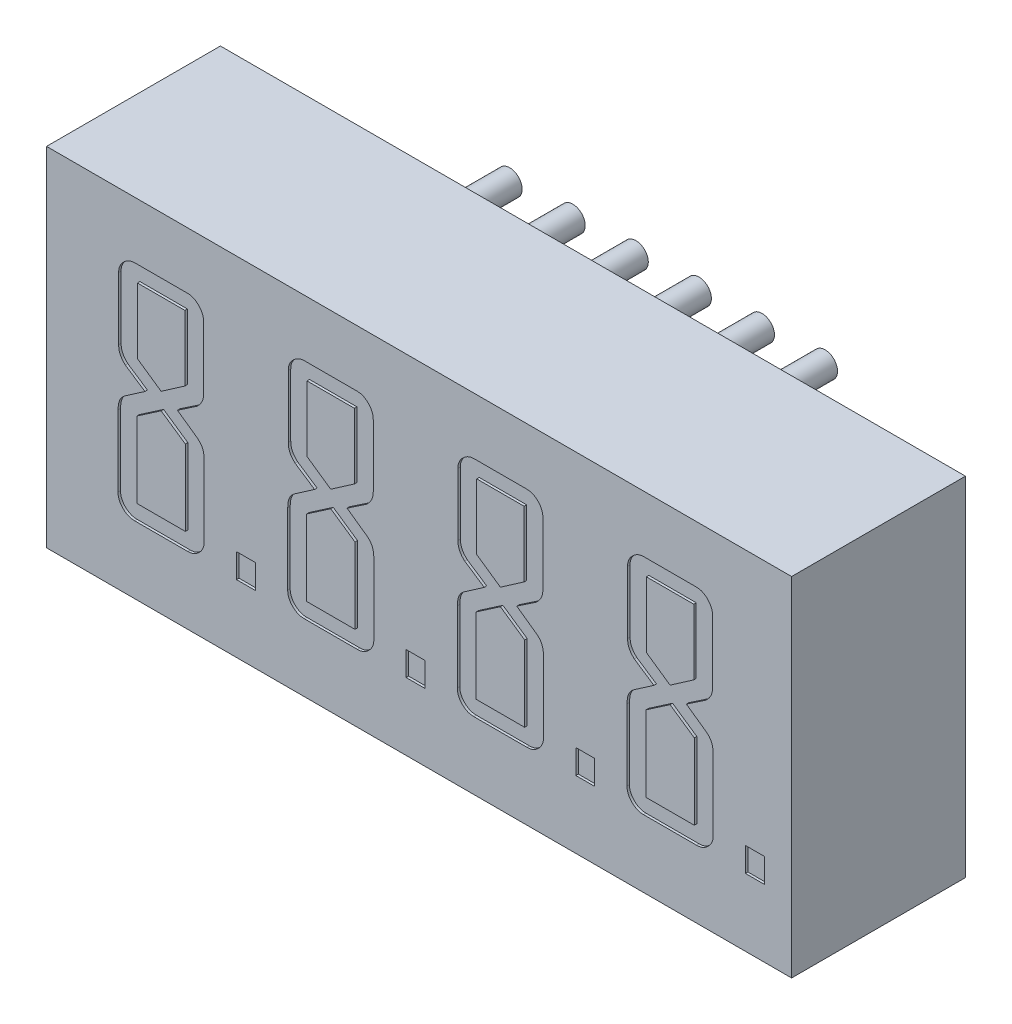
from build123d import *

# Parameters (mm, degrees)
SKETCH_1_W          = 30
SKETCH_1_H          = 14
EXTRUDE_1_DEPTH     = 7
SKETCH_2_R          = 0.5
EXTRUDE_2_DEPTH     = 3
SKETCH_3_W          = 0.759036144
SKETCH_3_H          = 0.975903615
SKETCH_3_W_2        = 0.759036145
CUT_EXTRUDE_1_DEPTH = 0.1


with BuildPart() as part:
    # 草图1 → 凸台-拉伸1 (new body)
    with BuildSketch(Plane.XY):
        Rectangle(SKETCH_1_W, SKETCH_1_H)
    extrude(amount=EXTRUDE_1_DEPTH)

    # 草图2 → 凸台-拉伸2 (add)
    with BuildSketch(Plane(origin=(0, 0, 0), x_dir=(-1, 0, 0), z_dir=(0, 0, -1))):
        with Locations((-6.35, -5.08)):
            Circle(SKETCH_2_R)
        with Locations((-3.81, -5.08)):
            Circle(SKETCH_2_R)
        with Locations((-1.27, -5.08)):
            Circle(SKETCH_2_R)
        with Locations((1.27, -5.08)):
            Circle(SKETCH_2_R)
        with Locations((3.81, -5.08)):
            Circle(SKETCH_2_R)
        with Locations((6.35, -5.08)):
            Circle(SKETCH_2_R)
        with Locations((-6.35, 5.08)):
            Circle(SKETCH_2_R)
        with Locations((-3.81, 5.08)):
            Circle(SKETCH_2_R)
        with Locations((-1.27, 5.08)):
            Circle(SKETCH_2_R)
        with Locations((1.27, 5.08)):
            Circle(SKETCH_2_R)
        with Locations((3.81, 5.08)):
            Circle(SKETCH_2_R)
        with Locations((6.35, 5.08)):
            Circle(SKETCH_2_R)
    extrude(amount=EXTRUDE_2_DEPTH)

    # 草图3 → 切除-拉伸1 (cut)
    # profile 1 of 8: a face of its own
    with BuildSketch(Plane.XY.offset(7)):
        with BuildLine():
            add(Edge.make_bspline(
                [(-8.652504459, -3.619299161), (-8.654362737, -3.66257673), (-8.658038164, -3.748173989), (-8.700630441, -3.870877019), (-8.763145764, -3.98628404), (-8.85161174, -4.088000843), (-8.954833811, -4.173294922), (-9.067943731, -4.237665873), (-9.189816429, -4.277361922), (-9.274011462, -4.281406816), (-9.316661085, -4.283455788)],
                knots=[0, 0, 0, 0, 0.997190107, 1.972309053, 2.972319829, 4.019608879, 5.068526684, 6.057120165, 7.015819712, 8, 8, 8, 8], degree=3))
            Line((-9.316661085, -4.283455788), (-11.45822735, -4.283455788))
            add(Edge.make_bspline(
                [(-11.45822735, -4.283455788), (-11.502017128, -4.281467222), (-11.587904853, -4.277566921), (-11.711873081, -4.237579103), (-11.826378976, -4.174282188), (-11.928373853, -4.087815088), (-12.015224794, -3.986210112), (-12.076151405, -3.870756342), (-12.116432187, -3.747885473), (-12.120382641, -3.662537314), (-12.122383977, -3.619299161)],
                knots=[0, 0, 0, 0, 1.007527941, 1.976129771, 2.97349409, 4.009605341, 5.045716591, 6.036847056, 7.005448885, 8, 8, 8, 8], degree=3))
            Line((-12.122383977, -3.619299161), (-12.122383977, -0.752582294))
            add(Edge.make_bspline(
                [(-12.122383977, -0.752582294), (-12.11964933, -0.684415019), (-12.114521929, -0.556602889), (-12.063204888, -0.379624731), (-11.975896076, -0.231930263), (-11.891426195, -0.162010932), (-11.849605362, -0.127394041)],
                knots=[0, 0, 0, 0, 1.150327782, 2.156839091, 3.087455516, 4, 4, 4, 4], degree=3))
            Line((-11.849605362, -0.127394041), (-11.038046627, 0.433411682))
            Line((-11.038046627, 0.433411682), (-11.82757976, 0.958637586))
            add(Edge.make_bspline(
                [(-11.82757976, 0.958637586), (-11.869036888, 0.998813623), (-11.949235147, 1.076533629), (-12.035762668, 1.218088737), (-12.089608975, 1.372748965), (-12.095608181, 1.481161938), (-12.098664097, 1.53638608)],
                knots=[0, 0, 0, 0, 1.048816126, 2.028920755, 2.995958189, 4, 4, 4, 4], degree=3))
            Line((-12.098664097, 1.53638608), (-12.098664097, 4.052387586))
            add(Edge.make_bspline(
                [(-12.098664097, 4.052387586), (-12.09682249, 4.095675708), (-12.093180038, 4.18129384), (-12.05059827, 4.303110244), (-11.989570188, 4.418524118), (-11.900583237, 4.519185082), (-11.798387754, 4.607079574), (-11.683042358, 4.670643367), (-11.559109386, 4.710661592), (-11.473216863, 4.714557756), (-11.429424639, 4.716544212)],
                knots=[0, 0, 0, 0, 0.99216494, 1.962369941, 2.939690395, 3.981701811, 5.033640061, 6.028611456, 6.994889369, 8, 8, 8, 8], degree=3))
            Line((-11.429424639, 4.716544212), (-9.328521025, 4.716544212))
            add(Edge.make_bspline(
                [(-9.328521025, 4.716544212), (-9.285848701, 4.714561088), (-9.202148942, 4.710671282), (-9.081561793, 4.670561392), (-8.969573202, 4.606956511), (-8.870625939, 4.518642196), (-8.783827481, 4.417993686), (-8.722056628, 4.303481126), (-8.682238749, 4.180944908), (-8.678246731, 4.09561599), (-8.676224338, 4.052387586)],
                knots=[0, 0, 0, 0, 0.992302972, 1.946355689, 2.931638389, 3.977580693, 5.025015187, 6.015392545, 6.994579835, 8, 8, 8, 8], degree=3))
            Line((-8.676224338, 4.052387586), (-8.676224338, 1.53638608))
            add(Edge.make_bspline(
                [(-8.676224338, 1.53638608), (-8.679136007, 1.481119191), (-8.684861714, 1.372438562), (-8.741027983, 1.217948384), (-8.829144577, 1.076453744), (-8.910375891, 0.998801819), (-8.952391507, 0.958637586)],
                knots=[0, 0, 0, 0, 1.000069684, 1.966606104, 2.948259069, 4, 4, 4, 4], degree=3))
            Line((-8.952391507, 0.958637586), (-9.730064699, 0.433411682))
            Line((-9.730064699, 0.433411682), (-8.93883729, -0.127394041))
            add(Edge.make_bspline(
                [(-8.93883729, -0.127394041), (-8.894660406, -0.162989963), (-8.806528859, -0.234002752), (-8.715220385, -0.383675857), (-8.662488686, -0.559868435), (-8.655948448, -0.686107004), (-8.652504459, -0.752582294)],
                knots=[0, 0, 0, 0, 0.945503828, 1.88625157, 2.886932559, 4, 4, 4, 4], degree=3))
            Line((-8.652504459, -0.752582294), (-8.652504459, -3.619299161))
        make_face()
        Polygon((-9.433566205, 1.426258068), (-9.433566205, 4.065941803), (-11.34132223, 4.065941803), (-11.34132223, 1.426258068), (-10.387444218, 0.765489995), align=None, mode=Mode.SUBTRACT)
        Polygon((-9.411540603, -3.632853378), (-9.411540603, -0.58484886), (-10.387444218, 0.084390598), (-11.363347832, -0.58484886), (-11.363347832, -3.632853378), align=None, mode=Mode.SUBTRACT)
    # profile 2 of 8: a face of its own
    with BuildSketch(Plane.XY.offset(7)):
        with Locations((-6.971781567, -3.795503981)):
            Rectangle(SKETCH_3_W, SKETCH_3_H)
    # profile 3 of 8: a face of its own
    with BuildSketch(Plane.XY.offset(7)):
        with BuildLine():
            add(Edge.make_bspline(
                [(-1.821179157, -3.619299161), (-1.823037436, -3.66257673), (-1.826712863, -3.748173989), (-1.86930514, -3.870877019), (-1.931820462, -3.98628404), (-2.020286439, -4.088000843), (-2.12350851, -4.173294922), (-2.236618429, -4.237665873), (-2.358491128, -4.277361922), (-2.442686161, -4.281406816), (-2.485335784, -4.283455788)],
                knots=[0, 0, 0, 0, 0.997190107, 1.972309053, 2.972319829, 4.019608879, 5.068526684, 6.057120165, 7.015819712, 8, 8, 8, 8], degree=3))
            Line((-2.485335784, -4.283455788), (-4.626902049, -4.283455788))
            add(Edge.make_bspline(
                [(-4.626902049, -4.283455788), (-4.670691827, -4.281467222), (-4.756579552, -4.277566921), (-4.880547779, -4.237579103), (-4.995053675, -4.174282188), (-5.097048552, -4.087815088), (-5.183899493, -3.986210112), (-5.244826104, -3.870756342), (-5.285106886, -3.747885473), (-5.28905734, -3.662537314), (-5.291058675, -3.619299161)],
                knots=[0, 0, 0, 0, 1.007527941, 1.976129771, 2.97349409, 4.009605341, 5.045716591, 6.036847056, 7.005448885, 8, 8, 8, 8], degree=3))
            Line((-5.291058675, -3.619299161), (-5.291058675, -0.752582294))
            add(Edge.make_bspline(
                [(-5.291058675, -0.752582294), (-5.288324029, -0.684415019), (-5.283196628, -0.556602889), (-5.231879586, -0.379624731), (-5.144570775, -0.231930263), (-5.060100894, -0.162010932), (-5.018280061, -0.127394041)],
                knots=[0, 0, 0, 0, 1.150327782, 2.156839091, 3.087455516, 4, 4, 4, 4], degree=3))
            Line((-5.018280061, -0.127394041), (-4.206721326, 0.433411682))
            Line((-4.206721326, 0.433411682), (-4.996254459, 0.958637586))
            add(Edge.make_bspline(
                [(-4.996254459, 0.958637586), (-5.037711587, 0.998813623), (-5.117909846, 1.076533629), (-5.204437367, 1.218088737), (-5.258283674, 1.372748965), (-5.26428288, 1.481161938), (-5.267338796, 1.53638608)],
                knots=[0, 0, 0, 0, 1.048816126, 2.028920755, 2.995958189, 4, 4, 4, 4], degree=3))
            Line((-5.267338796, 1.53638608), (-5.267338796, 4.052387586))
            add(Edge.make_bspline(
                [(-5.267338796, 4.052387586), (-5.265497189, 4.095675708), (-5.261854736, 4.18129384), (-5.219272968, 4.303110244), (-5.158244887, 4.418524118), (-5.069257936, 4.519185082), (-4.967062453, 4.607079574), (-4.851717056, 4.670643367), (-4.727784084, 4.710661592), (-4.641891562, 4.714557756), (-4.598099338, 4.716544212)],
                knots=[0, 0, 0, 0, 0.99216494, 1.962369941, 2.939690395, 3.981701811, 5.033640061, 6.028611456, 6.994889369, 8, 8, 8, 8], degree=3))
            Line((-4.598099338, 4.716544212), (-2.497195724, 4.716544212))
            add(Edge.make_bspline(
                [(-2.497195724, 4.716544212), (-2.4545234, 4.714561088), (-2.370823641, 4.710671282), (-2.250236492, 4.670561392), (-2.1382479, 4.606956511), (-2.039300637, 4.518642196), (-1.95250218, 4.417993686), (-1.890731327, 4.303481126), (-1.850913448, 4.180944908), (-1.84692143, 4.09561599), (-1.844899037, 4.052387586)],
                knots=[0, 0, 0, 0, 0.992302972, 1.946355689, 2.931638389, 3.977580693, 5.025015187, 6.015392545, 6.994579835, 8, 8, 8, 8], degree=3))
            Line((-1.844899037, 4.052387586), (-1.844899037, 1.53638608))
            add(Edge.make_bspline(
                [(-1.844899037, 1.53638608), (-1.847810706, 1.481119191), (-1.853536413, 1.372438562), (-1.909702682, 1.217948384), (-1.997819276, 1.076453744), (-2.079050589, 0.998801819), (-2.121066205, 0.958637586)],
                knots=[0, 0, 0, 0, 1.000069684, 1.966606104, 2.948259069, 4, 4, 4, 4], degree=3))
            Line((-2.121066205, 0.958637586), (-2.898739398, 0.433411682))
            Line((-2.898739398, 0.433411682), (-2.107511989, -0.127394041))
            add(Edge.make_bspline(
                [(-2.107511989, -0.127394041), (-2.063335105, -0.162989963), (-1.975203558, -0.234002752), (-1.883895083, -0.383675857), (-1.831163385, -0.559868435), (-1.824623146, -0.686107004), (-1.821179157, -0.752582294)],
                knots=[0, 0, 0, 0, 0.945503828, 1.88625157, 2.886932559, 4, 4, 4, 4], degree=3))
            Line((-1.821179157, -0.752582294), (-1.821179157, -3.619299161))
        make_face()
        Polygon((-2.602240904, 1.426258068), (-2.602240904, 4.065941803), (-4.509996928, 4.065941803), (-4.509996928, 1.426258068), (-3.556118916, 0.765489995), align=None, mode=Mode.SUBTRACT)
        Polygon((-2.580215302, -3.632853378), (-2.580215302, -0.58484886), (-3.556118916, 0.084390598), (-4.532022531, -0.58484886), (-4.532022531, -3.632853378), align=None, mode=Mode.SUBTRACT)
    # profile 4 of 8: a face of its own
    with BuildSketch(Plane.XY.offset(7)):
        with Locations((-0.140456266, -3.795503981)):
            Rectangle(SKETCH_3_W_2, SKETCH_3_H)
    # profile 5 of 8: a face of its own
    with BuildSketch(Plane.XY.offset(7)):
        with BuildLine():
            add(Edge.make_bspline(
                [(5.010146144, -3.619299161), (5.008287865, -3.66257673), (5.004612438, -3.748173989), (4.962020161, -3.870877019), (4.899504839, -3.98628404), (4.811038862, -4.088000843), (4.707816791, -4.173294922), (4.594706872, -4.237665873), (4.472834174, -4.277361922), (4.38863914, -4.281406816), (4.345989517, -4.283455788)],
                knots=[0, 0, 0, 0, 0.997190107, 1.972309053, 2.972319829, 4.019608879, 5.068526684, 6.057120165, 7.015819712, 8, 8, 8, 8], degree=3))
            Line((4.345989517, -4.283455788), (2.204423252, -4.283455788))
            add(Edge.make_bspline(
                [(2.204423252, -4.283455788), (2.160633475, -4.281467222), (2.074745749, -4.277566921), (1.950777522, -4.237579103), (1.836271626, -4.174282188), (1.73427675, -4.087815088), (1.647425809, -3.986210112), (1.586499197, -3.870756342), (1.546218415, -3.747885473), (1.542267962, -3.662537314), (1.540266626, -3.619299161)],
                knots=[0, 0, 0, 0, 1.007527941, 1.976129771, 2.97349409, 4.009605341, 5.045716591, 6.036847056, 7.005448885, 8, 8, 8, 8], degree=3))
            Line((1.540266626, -3.619299161), (1.540266626, -0.752582294))
            add(Edge.make_bspline(
                [(1.540266626, -0.752582294), (1.543001272, -0.684415019), (1.548128673, -0.556602889), (1.599445715, -0.379624731), (1.686754526, -0.231930263), (1.771224408, -0.162010932), (1.81304524, -0.127394041)],
                knots=[0, 0, 0, 0, 1.150327782, 2.156839091, 3.087455516, 4, 4, 4, 4], degree=3))
            Line((1.81304524, -0.127394041), (2.624603975, 0.433411682))
            Line((2.624603975, 0.433411682), (1.835070843, 0.958637586))
            add(Edge.make_bspline(
                [(1.835070843, 0.958637586), (1.793613715, 0.998813623), (1.713415455, 1.076533629), (1.626887935, 1.218088737), (1.573041627, 1.372748965), (1.567042422, 1.481161938), (1.563986505, 1.53638608)],
                knots=[0, 0, 0, 0, 1.048816126, 2.028920755, 2.995958189, 4, 4, 4, 4], degree=3))
            Line((1.563986505, 1.53638608), (1.563986505, 4.052387586))
            add(Edge.make_bspline(
                [(1.563986505, 4.052387586), (1.565828112, 4.095675708), (1.569470565, 4.18129384), (1.612052333, 4.303110244), (1.673080414, 4.418524118), (1.762067366, 4.519185082), (1.864262848, 4.607079574), (1.979608245, 4.670643367), (2.103541217, 4.710661592), (2.18943374, 4.714557756), (2.233225963, 4.716544212)],
                knots=[0, 0, 0, 0, 0.99216494, 1.962369941, 2.939690395, 3.981701811, 5.033640061, 6.028611456, 6.994889369, 8, 8, 8, 8], degree=3))
            Line((2.233225963, 4.716544212), (4.334129578, 4.716544212))
            add(Edge.make_bspline(
                [(4.334129578, 4.716544212), (4.376801901, 4.714561088), (4.460501661, 4.710671282), (4.581088809, 4.670561392), (4.693077401, 4.606956511), (4.792024664, 4.518642196), (4.878823121, 4.417993686), (4.940593975, 4.303481126), (4.980411853, 4.180944908), (4.984403872, 4.09561599), (4.986426264, 4.052387586)],
                knots=[0, 0, 0, 0, 0.992302972, 1.946355689, 2.931638389, 3.977580693, 5.025015187, 6.015392545, 6.994579835, 8, 8, 8, 8], degree=3))
            Line((4.986426264, 4.052387586), (4.986426264, 1.53638608))
            add(Edge.make_bspline(
                [(4.986426264, 1.53638608), (4.983514595, 1.481119191), (4.977788888, 1.372438562), (4.921622619, 1.217948384), (4.833506025, 1.076453744), (4.752274712, 0.998801819), (4.710259096, 0.958637586)],
                knots=[0, 0, 0, 0, 1.000069684, 1.966606104, 2.948259069, 4, 4, 4, 4], degree=3))
            Line((4.710259096, 0.958637586), (3.932585903, 0.433411682))
            Line((3.932585903, 0.433411682), (4.723813313, -0.127394041))
            add(Edge.make_bspline(
                [(4.723813313, -0.127394041), (4.767990196, -0.162989963), (4.856121743, -0.234002752), (4.947430218, -0.383675857), (5.000161917, -0.559868435), (5.006702155, -0.686107004), (5.010146144, -0.752582294)],
                knots=[0, 0, 0, 0, 0.945503828, 1.88625157, 2.886932559, 4, 4, 4, 4], degree=3))
            Line((5.010146144, -0.752582294), (5.010146144, -3.619299161))
        make_face()
        Polygon((4.229084397, 1.426258068), (4.229084397, 4.065941803), (2.321328373, 4.065941803), (2.321328373, 1.426258068), (3.275206385, 0.765489995), align=None, mode=Mode.SUBTRACT)
        Polygon((4.251109999, -3.632853378), (4.251109999, -0.58484886), (3.275206385, 0.084390598), (2.29930277, -0.58484886), (2.29930277, -3.632853378), align=None, mode=Mode.SUBTRACT)
    # profile 6 of 8: a face of its own
    with BuildSketch(Plane.XY.offset(7)):
        with Locations((6.690869036, -3.795503981)):
            Rectangle(SKETCH_3_W_2, SKETCH_3_H)
    # profile 7 of 8: a face of its own
    with BuildSketch(Plane.XY.offset(7)):
        with BuildLine():
            add(Edge.make_bspline(
                [(11.841471445, -3.619299161), (11.839613167, -3.66257673), (11.83593774, -3.748173989), (11.793345462, -3.870877019), (11.73083014, -3.98628404), (11.642364164, -4.088000843), (11.539142093, -4.173294922), (11.426032173, -4.237665873), (11.304159475, -4.277361922), (11.219964441, -4.281406816), (11.177314819, -4.283455788)],
                knots=[0, 0, 0, 0, 0.997190107, 1.972309053, 2.972319829, 4.019608879, 5.068526684, 6.057120165, 7.015819712, 8, 8, 8, 8], degree=3))
            Line((11.177314819, -4.283455788), (9.035748554, -4.283455788))
            add(Edge.make_bspline(
                [(9.035748554, -4.283455788), (8.991958776, -4.281467222), (8.90607105, -4.277566921), (8.782102823, -4.237579103), (8.667596927, -4.174282188), (8.565602051, -4.087815088), (8.47875111, -3.986210112), (8.417824499, -3.870756342), (8.377543717, -3.747885473), (8.373593263, -3.662537314), (8.371591927, -3.619299161)],
                knots=[0, 0, 0, 0, 1.007527941, 1.976129771, 2.97349409, 4.009605341, 5.045716591, 6.036847056, 7.005448885, 8, 8, 8, 8], degree=3))
            Line((8.371591927, -3.619299161), (8.371591927, -0.752582294))
            add(Edge.make_bspline(
                [(8.371591927, -0.752582294), (8.374326573, -0.684415019), (8.379453974, -0.556602889), (8.430771016, -0.379624731), (8.518079828, -0.231930263), (8.602549709, -0.162010932), (8.644370541, -0.127394041)],
                knots=[0, 0, 0, 0, 1.150327782, 2.156839091, 3.087455516, 4, 4, 4, 4], degree=3))
            Line((8.644370541, -0.127394041), (9.455929276, 0.433411682))
            Line((9.455929276, 0.433411682), (8.666396144, 0.958637586))
            add(Edge.make_bspline(
                [(8.666396144, 0.958637586), (8.624939016, 0.998813623), (8.544740756, 1.076533629), (8.458213236, 1.218088737), (8.404366929, 1.372748965), (8.398367723, 1.481161938), (8.395311807, 1.53638608)],
                knots=[0, 0, 0, 0, 1.048816126, 2.028920755, 2.995958189, 4, 4, 4, 4], degree=3))
            Line((8.395311807, 1.53638608), (8.395311807, 4.052387586))
            add(Edge.make_bspline(
                [(8.395311807, 4.052387586), (8.397153413, 4.095675708), (8.400795866, 4.18129384), (8.443377634, 4.303110244), (8.504405715, 4.418524118), (8.593392667, 4.519185082), (8.69558815, 4.607079574), (8.810933546, 4.670643367), (8.934866518, 4.710661592), (9.020759041, 4.714557756), (9.064551264, 4.716544212)],
                knots=[0, 0, 0, 0, 0.99216494, 1.962369941, 2.939690395, 3.981701811, 5.033640061, 6.028611456, 6.994889369, 8, 8, 8, 8], degree=3))
            Line((9.064551264, 4.716544212), (11.165454879, 4.716544212))
            add(Edge.make_bspline(
                [(11.165454879, 4.716544212), (11.208127202, 4.714561088), (11.291826962, 4.710671282), (11.41241411, 4.670561392), (11.524402702, 4.606956511), (11.623349965, 4.518642196), (11.710148423, 4.417993686), (11.771919276, 4.303481126), (11.811737154, 4.180944908), (11.815729173, 4.09561599), (11.817751566, 4.052387586)],
                knots=[0, 0, 0, 0, 0.992302972, 1.946355689, 2.931638389, 3.977580693, 5.025015187, 6.015392545, 6.994579835, 8, 8, 8, 8], degree=3))
            Line((11.817751566, 4.052387586), (11.817751566, 1.53638608))
            add(Edge.make_bspline(
                [(11.817751566, 1.53638608), (11.814839897, 1.481119191), (11.80911419, 1.372438562), (11.752947921, 1.217948384), (11.664831326, 1.076453744), (11.583600013, 0.998801819), (11.541584397, 0.958637586)],
                knots=[0, 0, 0, 0, 1.000069684, 1.966606104, 2.948259069, 4, 4, 4, 4], degree=3))
            Line((11.541584397, 0.958637586), (10.763911204, 0.433411682))
            Line((10.763911204, 0.433411682), (11.555138614, -0.127394041))
            add(Edge.make_bspline(
                [(11.555138614, -0.127394041), (11.599315497, -0.162989963), (11.687447045, -0.234002752), (11.778755519, -0.383675857), (11.831487218, -0.559868435), (11.838027456, -0.686107004), (11.841471445, -0.752582294)],
                knots=[0, 0, 0, 0, 0.945503828, 1.88625157, 2.886932559, 4, 4, 4, 4], degree=3))
            Line((11.841471445, -0.752582294), (11.841471445, -3.619299161))
        make_face()
        Polygon((11.060409698, 1.426258068), (11.060409698, 4.065941803), (9.152653674, 4.065941803), (9.152653674, 1.426258068), (10.106531686, 0.765489995), align=None, mode=Mode.SUBTRACT)
        Polygon((11.082435301, -3.632853378), (11.082435301, -0.58484886), (10.106531686, 0.084390598), (9.130628072, -0.58484886), (9.130628072, -3.632853378), align=None, mode=Mode.SUBTRACT)
    # profile 8 of 8: a face of its own
    with BuildSketch(Plane.XY.offset(7)):
        with Locations((13.522194337, -3.795503981)):
            Rectangle(SKETCH_3_W_2, SKETCH_3_H)
    extrude(amount=-CUT_EXTRUDE_1_DEPTH, mode=Mode.SUBTRACT)


solid = part.part
